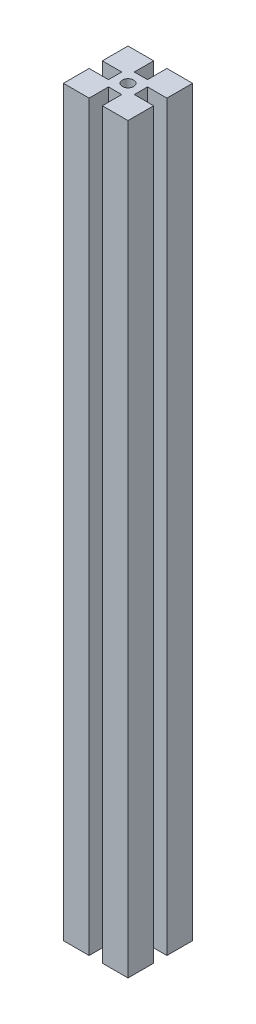
from build123d import *

# Parameters (mm, degrees)
AUFSATZ_LINEAR_AUSTRAGEN1_DEPTH      = 230
AUFSATZ_LINEAR_AUSTRAGEN1_DEPTH_BACK = 230
SKIZZE1_R                            = 3.5


with BuildPart() as part:
    # Skizze1 → Aufsatz-Linear austragen1 (new, two sides: drawn at the far end of the back side and taken through both)
    with BuildSketch(Plane(origin=(0, 0, 0), x_dir=(1, 0, 0), z_dir=(0, 1, 0)).offset(-AUFSATZ_LINEAR_AUSTRAGEN1_DEPTH_BACK)):
        Polygon((-4.1, -20), (-4.1, -8), (4.1, -8), (4.1, -20), (20, -20), (20, -4.1), (8, -4.1), (8, 4.1), (20, 4.1), (20, 20), (4.1, 20), (4.1, 8), (-4.1, 8), (-4.1, 20), (-20, 20), (-20, 4.1), (-8, 4.1), (-8, -4.1), (-20, -4.1), (-20, -20), align=None)
        Circle(SKIZZE1_R, mode=Mode.SUBTRACT)
    extrude(amount=AUFSATZ_LINEAR_AUSTRAGEN1_DEPTH + AUFSATZ_LINEAR_AUSTRAGEN1_DEPTH_BACK)


solid = part.part
